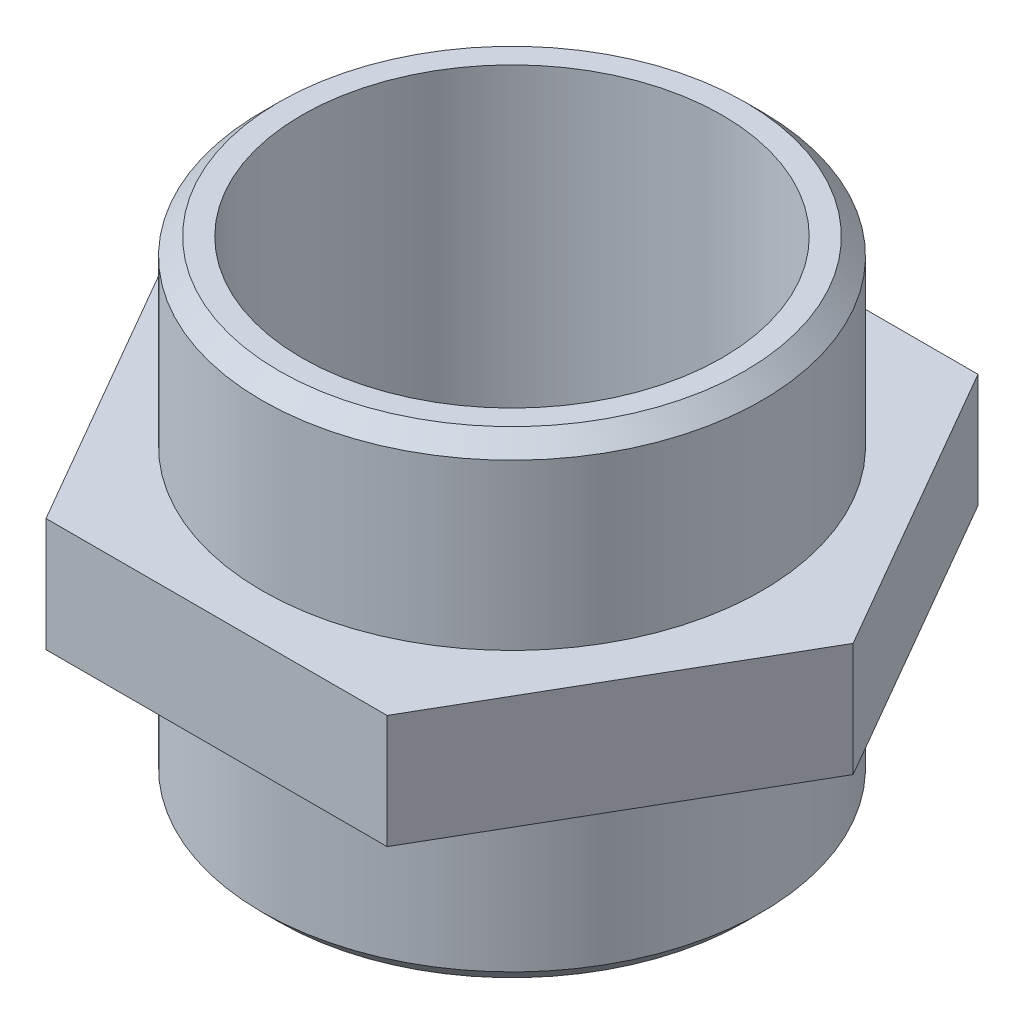
from build123d import *

# Parameters (mm, degrees)
SKETCH1_R           = 18.5
BOSS_EXTRUDE1_DEPTH = 5
SKETCH2_R           = 22
SKETCH2_R_2         = 18.5
BOSS_EXTRUDE2_DEPTH = 21
CHAMFER1_SIZE       = 1.5


with BuildPart() as part:
    # Sketch1 → Boss-Extrude1 (new, symmetric)
    with BuildSketch(Plane(origin=(0, 0, 0), x_dir=(1, 0, 0), z_dir=(0, 1, 0))):
        Polygon((15.011106999, -26), (30.022213998, 0), (15.011106999, 26), (-15.011106999, 26), (-30.022213998, 0), (-15.011106999, -26), align=None)
        with Locations(Location((0, 0, 0), (0, 0, 270))):
            Circle(SKETCH1_R, mode=Mode.SUBTRACT)
    extrude(amount=BOSS_EXTRUDE1_DEPTH, both=True)

    # Sketch2 → Boss-Extrude2 (add, symmetric)
    with BuildSketch(Plane(origin=(0, 0, 0), x_dir=(1, 0, 0), z_dir=(0, 1, 0))):
        with Locations(Location((0, 0, 0), (0, 0, 90))):
            Circle(SKETCH2_R)
        with Locations(Location((0, 0, 0), (0, 0, 270))):
            Circle(SKETCH2_R_2, mode=Mode.SUBTRACT)
    extrude(amount=BOSS_EXTRUDE2_DEPTH, both=True)

    # Chamfer1
    chamfer1_edges = [part.edges().sort_by_distance(p)[0] for p in [
        (0, -21, 22),
        (0, 21, 22),
    ]]
    chamfer(chamfer1_edges, length=CHAMFER1_SIZE)


solid = part.part
